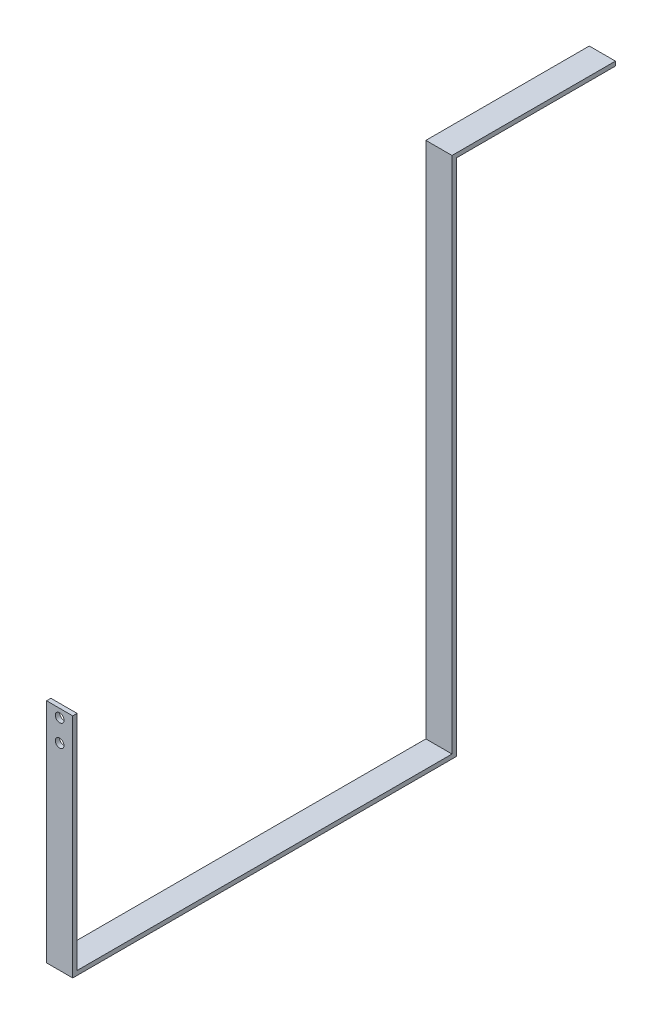
from build123d import *

# Parameters (mm, degrees)
CROQUIS1_W              = 38.1
CROQUIS1_H              = 6.31
SALIENTE_EXTRUIR1_DEPTH = 238.05
CROQUIS2_W              = 38.1
CROQUIS2_H              = 6.31
SALIENTE_EXTRUIR2_DEPTH = 755.1
CROQUIS3_W              = 38.1
CROQUIS3_H              = 6.31
SALIENTE_EXTRUIR3_DEPTH = 552.5
CROQUIS4_W              = 38.1
CROQUIS4_H              = 6.31
SALIENTE_EXTRUIR4_DEPTH = 314.39
CROQUIS6_W              = 38.1
CROQUIS6_H              = 6.31
SALIENTE_EXTRUIR5_DEPTH = 10
CROQUIS8_R              = 6.35
CORTAR_EXTRUIR1_DEPTH   = 10


with BuildPart() as part:
    # Croquis1 → Saliente-Extruir1 (new body)
    with BuildSketch(Plane.XY):
        Rectangle(CROQUIS1_W, CROQUIS1_H)
    extrude(amount=SALIENTE_EXTRUIR1_DEPTH)

    # Croquis2 → Saliente-Extruir2 (add)
    with BuildSketch(Plane.XZ.offset(3.155)):
        with Locations((0, 234.895)):
            Rectangle(CROQUIS2_W, CROQUIS2_H)
    extrude(amount=SALIENTE_EXTRUIR2_DEPTH)

    # Croquis3 → Saliente-Extruir3 (add)
    with BuildSketch(Plane.XY.offset(238.05)):
        with Locations((0, -755.1)):
            Rectangle(CROQUIS3_W, CROQUIS3_H)
    extrude(amount=SALIENTE_EXTRUIR3_DEPTH)

    # Croquis4 → Saliente-Extruir4 (add)
    with BuildSketch(Plane(origin=(0, -751.945, 0), x_dir=(1, 0, 0), z_dir=(0, 1, 0))):
        with Locations((0, -787.395)):
            Rectangle(CROQUIS4_W, CROQUIS4_H)
    extrude(amount=SALIENTE_EXTRUIR4_DEPTH)

    # Croquis6 → Saliente-Extruir5 (add)
    with BuildSketch(Plane(origin=(0, -437.555, 0), x_dir=(1, 0, 0), z_dir=(0, 1, 0))):
        with Locations((0, -787.395)):
            Rectangle(CROQUIS6_W, CROQUIS6_H)
    extrude(amount=SALIENTE_EXTRUIR5_DEPTH)

    # Croquis8 → Cortar-Extruir1 (cut)
    with BuildSketch(Plane.XY.offset(790.55)):
        with Locations((0, -471.447204666)):
            Circle(CROQUIS8_R)
        with Locations((0, -439.447204666)):
            Circle(CROQUIS8_R)
    extrude(amount=-CORTAR_EXTRUIR1_DEPTH, mode=Mode.SUBTRACT)


solid = part.part
